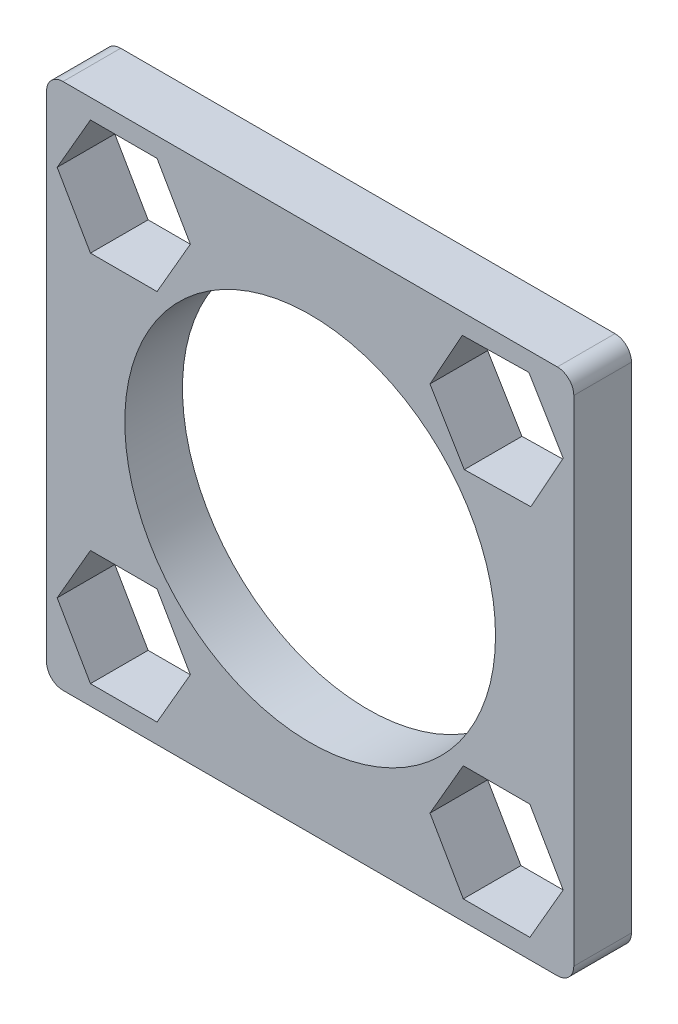
from build123d import *

# Parameters (mm, degrees)
SKETCH_1_R      = 11.25
EXTRUDE_2_DEPTH = 3.5


with BuildPart() as part:
    # Эскиз1 → Бобышка-Вытянуть2 (new body)
    with BuildSketch(Plane.XY):
        with BuildLine():
            Line((-15, 16), (15, 16))
            ThreePointArc((15, 16), (15.707106781, 15.707106781), (16, 15))
            Line((16, 15), (16, -15))
            ThreePointArc((16, -15), (15.707106781, -15.707106781), (15, -16))
            Line((15, -16), (-15, -16))
            ThreePointArc((-15, -16), (-15.707106781, -15.707106781), (-16, -15))
            Line((-16, -15), (-16, 15))
            ThreePointArc((-16, 15), (-15.707106781, 15.707106781), (-15, 16))
        make_face()
        Circle(SKETCH_1_R, mode=Mode.SUBTRACT)
        Polygon((-7.272256615, 11.313708499), (-9.292982557, 14.813708499), (-13.334434441, 14.813708499), (-15.355160383, 11.313708499), (-13.334434441, 7.813708499), (-9.292982557, 7.813708499), align=None, mode=Mode.SUBTRACT)
        Polygon((7.272859896, 11.243880856), (9.353756711, 7.779317134), (13.394605314, 7.849144778), (15.354557102, 11.383536142), (13.273660287, 14.848099864), (9.232811684, 14.77827222), align=None, mode=Mode.SUBTRACT)
        Polygon((-7.272256615, -11.313708499), (-9.292982557, -7.813708499), (-13.334434441, -7.813708499), (-15.355160383, -11.313708499), (-13.334434441, -14.813708499), (-9.292982557, -14.813708499), align=None, mode=Mode.SUBTRACT)
        Polygon((15.355160383, -11.313708499), (13.334434441, -7.813708499), (9.292982557, -7.813708499), (7.272256615, -11.313708499), (9.292982557, -14.813708499), (13.334434441, -14.813708499), align=None, mode=Mode.SUBTRACT)
    extrude(amount=EXTRUDE_2_DEPTH)


solid = part.part
